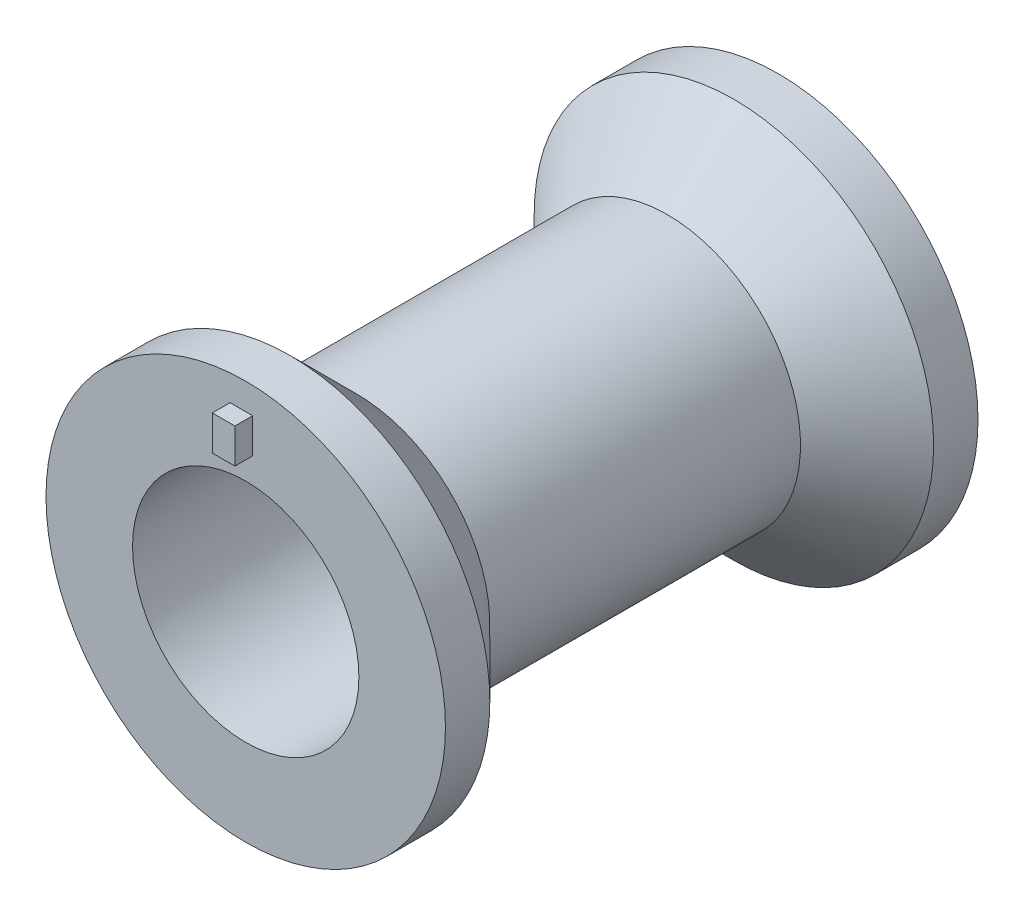
from build123d import *

# Parameters (mm, degrees)
SKETCH2_R           = 22.5
SKETCH2_R_2         = 12.75
BOSS_EXTRUDE1_DEPTH = 60
SKETCH4_W           = 2.545484213
SKETCH4_H           = 3.916129558
BOSS_EXTRUDE2_DEPTH = 2


with BuildPart() as part:
    # Sketch2 → Boss-Extrude1 (new body)
    with BuildSketch(Plane.XY):
        Circle(SKETCH2_R)
        Circle(SKETCH2_R_2, mode=Mode.SUBTRACT)
    extrude(amount=BOSS_EXTRUDE1_DEPTH)

    # Sketch3 → Cut-Revolve1 (revolve, cut)
    with BuildSketch(Plane(origin=(0, 0, 0), x_dir=(1, 0, 0), z_dir=(0, 1, 0)), mode=Mode.PRIVATE) as cut_revolve1_sk:
        Polygon((22.5, -5), (22.5, -55), (15, -47.5), (15, -12.5), align=None)
    revolve(cut_revolve1_sk.sketch.rotate(Axis((0, 0, -10.796502134), (0, 0, 1)), 180), axis=Axis((0, 0, -10.796502134), (0, 0, 1)), mode=Mode.SUBTRACT)

    # Sketch4 → Boss-Extrude2 (add)
    with BuildSketch(Plane.XY.offset(60)):
        with Locations((-0.489516195, 17.557314188)):
            Rectangle(SKETCH4_W, SKETCH4_H)
    extrude(amount=BOSS_EXTRUDE2_DEPTH)


solid = part.part
